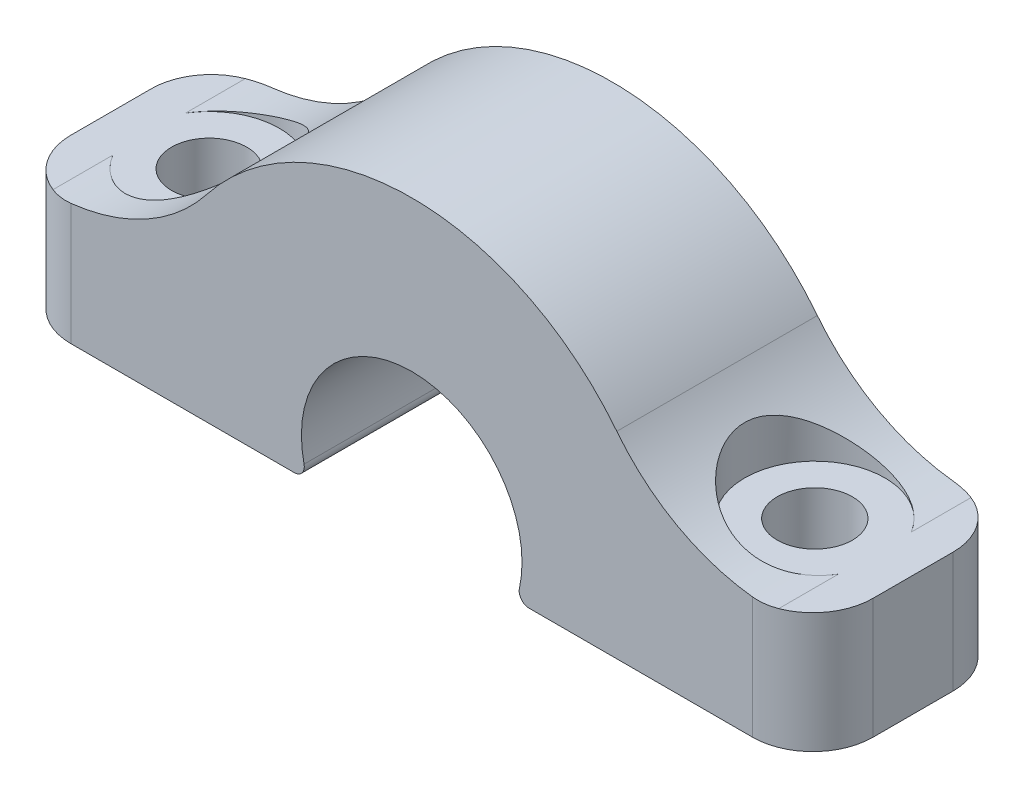
from build123d import *

# Parameters (mm, degrees)
BOSS_EXTRUDE1_START      = -1
SKETCH1_W                = 40
SKETCH1_H                = 10
BOSS_EXTRUDE1_DEPTH      = 5
BOSS_EXTRUDE2_DEPTH      = 5
BOSS_EXTRUDE2_DEPTH_BACK = 5
SKETCH3_W                = 10
SKETCH3_H                = 10
BOSS_EXTRUDE3_DEPTH      = 7
FILLET1_R                = 3
FILLET2_R                = 3
FILLET4_R                = 10
CUT_EXTRUDE1_DEPTH       = 26.973833083
CUT_EXTRUDE1_DEPTH_BACK  = 26.973833083
SKETCH4_R                = 1.875
CUT_EXTRUDE2_START       = 7
SKETCH5_R                = 3.5
CUT_EXTRUDE2_DEPTH       = 10
SKETCH9_W                = 47.094451366
SKETCH9_H                = 23.336565295
CUT_EXTRUDE5_DEPTH       = 1
FILLET5_R                = 0.5
SKETCH7_W                = 51.703075982
SKETCH7_H                = 23.04476915
CUT_EXTRUDE4_DEPTH       = 26.973833083


with BuildPart() as part:
    # Sketch1 → Boss-Extrude1 (new body)
    with BuildSketch(Plane(origin=(0, 0, 0), x_dir=(1, 0, 0), z_dir=(0, 1, 0)).offset(BOSS_EXTRUDE1_START)):
        Rectangle(SKETCH1_W, SKETCH1_H)
    extrude(amount=-BOSS_EXTRUDE1_DEPTH)

    # Fillet2
    fillet2_edges = [part.edges().sort_by_distance(p)[0] for p in [
        (-20, -3.5, 5),
        (-20, -3.5, -5),
        (20, -3.5, 5),
        (20, -3.5, -5),
    ]]
    fillet(fillet2_edges, radius=FILLET2_R)


with BuildPart() as body_2:
    # Sketch2 → Boss-Extrude2 (new, two sides: drawn at the far end of the back side and taken through both)
    with BuildSketch(Plane.XY.offset(-BOSS_EXTRUDE2_DEPTH_BACK)):
        with BuildLine():
            Line((-12.694880858, 0), (-4.733920151, 0))
            ThreePointArc((-4.733920151, 0), (0, 8.3), (4.733920151, 0))
            Line((4.733920151, 0), (12.694880858, 0))
            ThreePointArc((12.694880858, 0), (0, 15.8), (-12.694880858, 0))
        make_face()
    extrude(amount=BOSS_EXTRUDE2_DEPTH + BOSS_EXTRUDE2_DEPTH_BACK)

    # Sketch3 → Boss-Extrude3 (add)
    with BuildSketch(Plane(origin=(0, 0, 0), x_dir=(1, 0, 0), z_dir=(0, 1, 0))):
        with Locations((-15, 0)):
            Rectangle(SKETCH3_W, SKETCH3_H)
        with Locations((15, 0)):
            Rectangle(SKETCH3_W, SKETCH3_H)
    extrude(amount=BOSS_EXTRUDE3_DEPTH)

    # Fillet1
    fillet1_edges = [body_2.edges().sort_by_distance(p)[0] for p in [
        (20, 3.5, -5),
        (20, 3.5, 5),
        (-20, 3.5, -5),
        (-20, 3.5, 5),
    ]]
    fillet(fillet1_edges, radius=FILLET1_R)

    # Fillet4
    fillet4_edges = [body_2.edges().sort_by_distance(p)[0] for p in [
        (12.302845199, 7, 0),
        (-12.302845199, 7, 0),
    ]]
    fillet(fillet4_edges, radius=FILLET4_R)


with BuildPart() as cut_extrude1_tool:
    # Sketch4 → Cut-Extrude1 (new, two sides: drawn at the far end of the back side and taken through both)
    with BuildSketch(Plane(origin=(0, 0, 0), x_dir=(1, 0, 0), z_dir=(0, 1, 0)).offset(-CUT_EXTRUDE1_DEPTH_BACK)):
        with Locations((-15.1, 0)):
            Circle(SKETCH4_R)
        with Locations((15.1, 0)):
            Circle(SKETCH4_R)
    extrude(amount=CUT_EXTRUDE1_DEPTH + CUT_EXTRUDE1_DEPTH_BACK)


with BuildPart() as part_1:
    add(part.part)

    # Cut-Extrude1: cut by cut_extrude1_tool
    add(cut_extrude1_tool.part, mode=Mode.SUBTRACT)

    # Sketch7 → Cut-Extrude4 (cut, through all)
    with BuildSketch(Plane(origin=(0, 0, 0), x_dir=(1, 0, 0), z_dir=(0, 1, 0))):
        with Locations((-1.693322056, -1.721439234)):
            Rectangle(SKETCH7_W, SKETCH7_H)
    extrude(amount=-CUT_EXTRUDE4_DEPTH, mode=Mode.SUBTRACT)


with BuildPart() as body_2_1:
    add(body_2.part)

    # Cut-Extrude1: cut by cut_extrude1_tool
    add(cut_extrude1_tool.part, mode=Mode.SUBTRACT)

    # Sketch5 → Cut-Extrude2 (cut)
    with BuildSketch(Plane(origin=(0, 0, 0), x_dir=(1, 0, 0), z_dir=(0, 1, 0)).offset(CUT_EXTRUDE2_START)):
        with Locations((-15.1, 0)):
            Circle(SKETCH5_R)
        with Locations((15.1, 0)):
            Circle(SKETCH5_R)
    extrude(amount=CUT_EXTRUDE2_DEPTH, mode=Mode.SUBTRACT)

    # Sketch9 → Cut-Extrude5 (cut)
    with BuildSketch(Plane(origin=(0, 0, 0), x_dir=(1, 0, 0), z_dir=(0, 1, 0))):
        with Locations((2.081495267, 0.004136026)):
            Rectangle(SKETCH9_W, SKETCH9_H)
    extrude(amount=CUT_EXTRUDE5_DEPTH, mode=Mode.SUBTRACT)

    # Fillet5
    fillet5_edges = [body_2_1.edges().sort_by_distance(p)[0] for p in [
        (-5.197114584, 1, 0),
        (5.197114584, 1, 0),
    ]]
    fillet(fillet5_edges, radius=FILLET5_R)


solid = body_2_1.part
